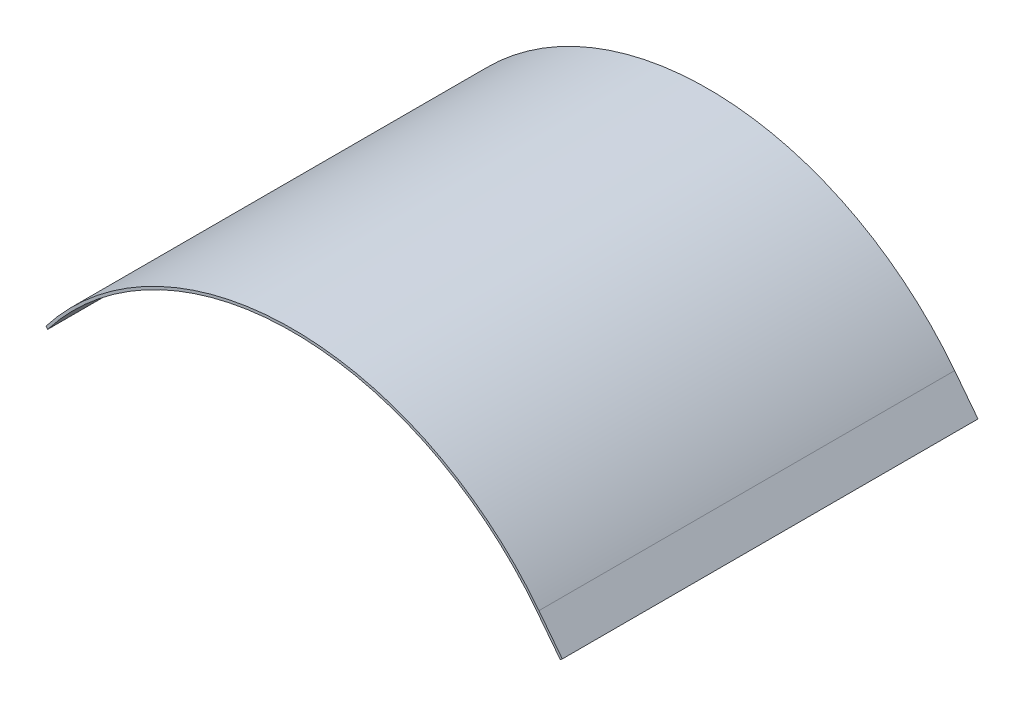
from build123d import *

# Parameters (mm, degrees)
BOSS_EXTRUDE1_DEPTH = 1600


with BuildPart() as part:
    # Sketch1 → Boss-Extrude1 (new body)
    with BuildSketch(Plane.XY):
        with BuildLine():
            Line((1897.37, 0), (1987.30887071, -116.111138292))
            Line((1987.30887071, -116.111138292), (1979.403162377, -122.234844339))
            Line((1979.403162377, -122.234844339), (1889.464291667, -6.123706047))
            ThreePointArc((1889.464291667, -6.123706047), (948.685, 455.155274378), (7.905708333, -6.123706047))
            Line((7.905708333, -6.123706047), (6.326316618, -8.167278707))
            Line((6.326316618, -8.167278707), (0, 0))
            ThreePointArc((0, 0), (948.685, 465.155274378), (1897.37, 0))
        make_face()
    extrude(amount=BOSS_EXTRUDE1_DEPTH)


solid = part.part
